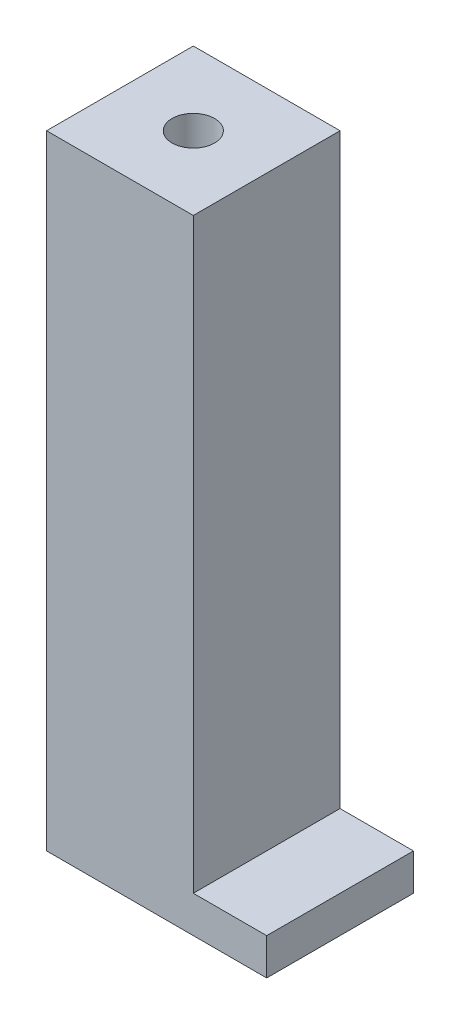
from build123d import *

# Parameters (mm, degrees)
SKETCH_1_W          = 20
SKETCH_1_H          = 20
EXTRUDE_1_DEPTH     = 80
SKETCH_3_W          = 30
SKETCH_3_H          = 20
EXTRUDE_2_DEPTH     = 5
SKETCH_4_R          = 2.9
CUT_EXTRUDE_1_DEPTH = 10


with BuildPart() as part:
    # 草图1 → 凸台-拉伸1 (new body)
    with BuildSketch(Plane(origin=(0, 0, 0), x_dir=(1, 0, 0), z_dir=(0, 1, 0))):
        Rectangle(SKETCH_1_W, SKETCH_1_H)
    extrude(amount=EXTRUDE_1_DEPTH)

    # 草图3 → 凸台-拉伸2 (add)
    with BuildSketch(Plane(origin=(0, 0, 0), x_dir=(-1, 0, 0), z_dir=(0, -1, 0))):
        with Locations((-5, 0)):
            Rectangle(SKETCH_3_W, SKETCH_3_H)
    extrude(amount=EXTRUDE_2_DEPTH)

    # 草图4 → 切除-拉伸1 (cut)
    with BuildSketch(Plane(origin=(0, 80, 0), x_dir=(1, 0, 0), z_dir=(0, 1, 0))):
        with Locations(Location((0, 0, 0), (0, 0, 270))):
            Circle(SKETCH_4_R)
    extrude(amount=-CUT_EXTRUDE_1_DEPTH, mode=Mode.SUBTRACT)


solid = part.part
